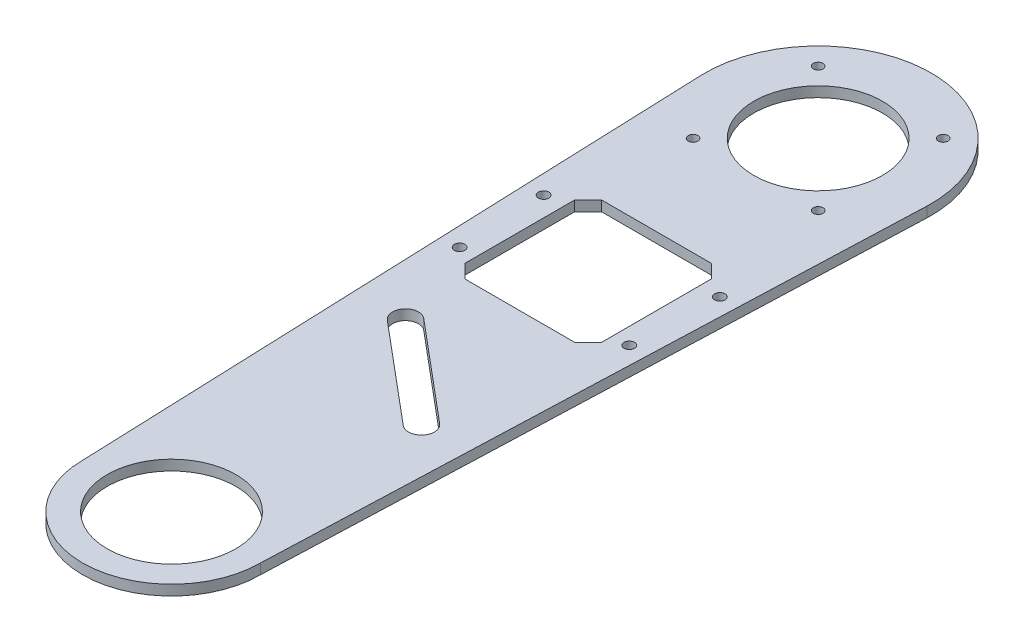
from build123d import *

# Parameters (mm, degrees)
BOSS_EXTRUDE1_DEPTH     = 3.175
SKETCH2_R               = 19.9
CUT_EXTRUDE1_DEPTH      = 140.49939292
ESQUISSE2_R             = 1.5
ENL_V_MAT_EXTRU_1_DEPTH = 140.49939292
SKETCH5_R               = 1.625
CUT_EXTRUDE3_DEPTH      = 140.49939292
CUT_EXTRUDE4_DEPTH      = 140.49939292


with BuildPart() as part:
    # Sketch1 → Boss-Extrude1 (new body)
    with BuildSketch(Plane(origin=(0, 0, 0), x_dir=(1, 0, 0), z_dir=(0, 1, 0))):
        with BuildLine():
            Line((-27.5, -100), (-34.975254116, 98.684097441))
            ThreePointArc((-34.975254116, 98.684097441), (0, 135), (34.975254116, 98.684097441))
            Line((34.975254116, 98.684097441), (27.5, -100))
            ThreePointArc((27.5, -100), (0, -127.5), (-27.5, -100))
        make_face()
    extrude(amount=BOSS_EXTRUDE1_DEPTH)

    # Sketch2 → Cut-Extrude1 (cut, through all)
    with BuildSketch(Plane(origin=(0, 3.175, 0), x_dir=(1, 0, 0), z_dir=(0, 1, 0))):
        with Locations(Location((0, -100, 0), (0, 0, 270))):
            Circle(SKETCH2_R)
        with Locations(Location((0, 100, 0), (0, 0, 270))):
            Circle(SKETCH2_R)
    extrude(amount=-CUT_EXTRUDE1_DEPTH, mode=Mode.SUBTRACT)

    # Esquisse2 → Enlèv. mat.-Extru.1 (cut, through all)
    with BuildSketch(Plane(origin=(0, 3.175, 0), x_dir=(1, 0, 0), z_dir=(0, 1, 0))):
        with Locations(Location((19.339370465, 80.660629535, 0), (0, 0, 270))):
            Circle(ESQUISSE2_R)
        with Locations(Location((19.339370465, 119.339370465, 0), (0, 0, 270))):
            Circle(ESQUISSE2_R)
        with Locations(Location((-19.339370465, 119.339370465, 0), (0, 0, 270))):
            Circle(ESQUISSE2_R)
        with Locations(Location((-19.339370465, 80.660629535, 0), (0, 0, 270))):
            Circle(ESQUISSE2_R)
    extrude(amount=-ENL_V_MAT_EXTRU_1_DEPTH, mode=Mode.SUBTRACT)

    # Sketch5 → Cut-Extrude3 (cut, through all)
    with BuildSketch(Plane(origin=(0, 3.175, 0), x_dir=(1, 0, 0), z_dir=(0, 1, 0))):
        with Locations(Location((-27.256476824, 42.340455159, 0), (0, 0, 270))):
            Circle(SKETCH5_R)
        with Locations(Location((-26.241351992, 15.359544841, 0), (0, 0, 270))):
            Circle(SKETCH5_R)
        with Locations(Location((26.241351992, 15.359544841, 0), (0, 0, 270))):
            Circle(SKETCH5_R)
        with Locations(Location((27.256476824, 42.340455159, 0), (0, 0, 270))):
            Circle(SKETCH5_R)
        Polygon((-21.15, 45.828069991), (-16.978069991, 50), (16.978069991, 50), (21.15, 45.828069991), (21.15, 11.871930009), (16.978069991, 7.7), (-16.978069991, 7.7), (-21.15, 11.871930009), align=None)
    extrude(amount=-CUT_EXTRUDE3_DEPTH, mode=Mode.SUBTRACT)

    # Sketch7 → Cut-Extrude4 (cut, through all)
    with BuildSketch(Plane(origin=(0, 3.175, 0), x_dir=(1, 0, 0), z_dir=(0, 1, 0))):
        with BuildLine():
            Line((17.892039301, -34.947326615), (-12.749738424, -9.235822228))
            ThreePointArc((-12.749738424, -9.235822228), (-18.385066635, -9.728849561), (-17.892039301, -15.364177772))
            Line((-17.892039301, -15.364177772), (12.749738424, -41.07568216))
            ThreePointArc((12.749738424, -41.07568216), (18.385066635, -40.582654826), (17.892039301, -34.947326615))
        make_face()
    extrude(amount=-CUT_EXTRUDE4_DEPTH, mode=Mode.SUBTRACT)


solid = part.part
